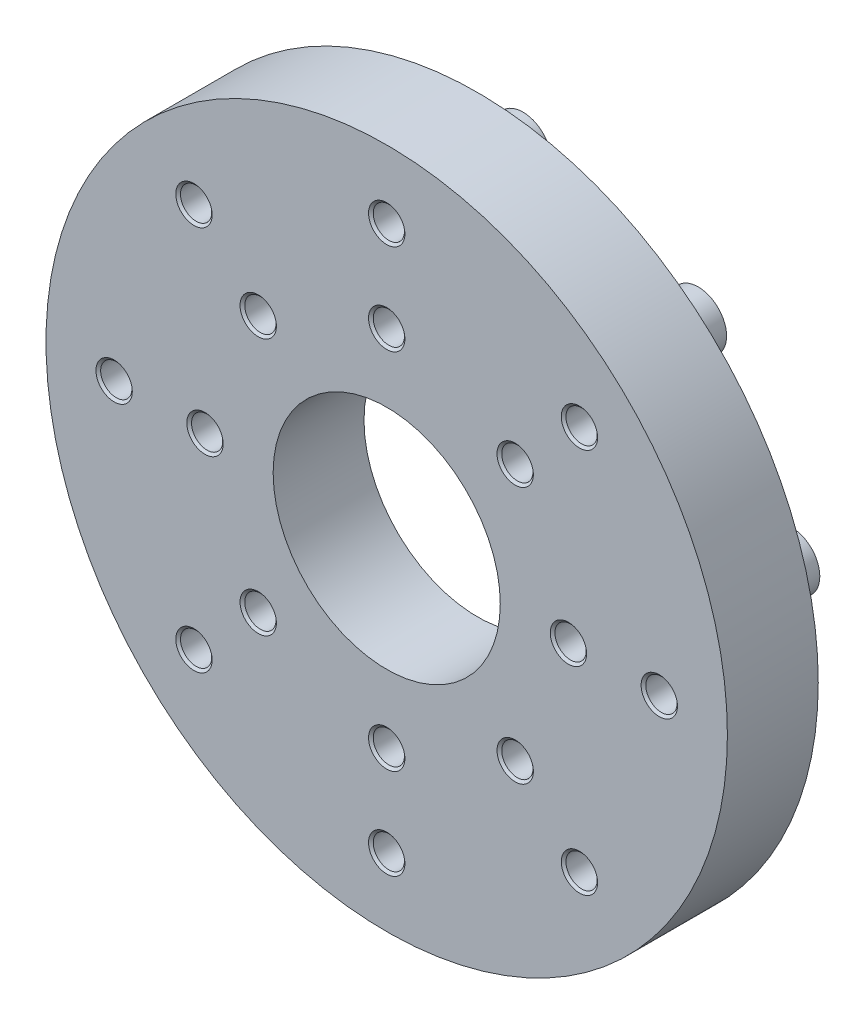
from build123d import *

# Parameters (mm, degrees)
SKETCH1_R                         = 190.5
BOSS_EXTRUDE1_DEPTH               = 50.8
SKETCH2_R                         = 63.5
CUT_EXTRUDE1_DEPTH                = 275.155320941
F_3_4_16_TAPPED_HOLE1_D           = 17.4625
F_3_4_16_TAPPED_HOLE1_DEPTH       = 42.926
F_3_4_16_TAPPED_HOLE1_CSINK_D     = 20.32
F_3_4_16_TAPPED_HOLE1_CSINK_ANGLE = 100
F_3_4_16_TAPPED_HOLE1_TIP         = 5.24626428
SKETCH5_R                         = 15.875
BOSS_EXTRUDE2_DEPTH               = 25.4


with BuildPart() as part:
    # Sketch1 → Boss-Extrude1 (new body)
    with BuildSketch(Plane.XY):
        Circle(SKETCH1_R)
    extrude(amount=BOSS_EXTRUDE1_DEPTH)

    # Sketch2 → Cut-Extrude1 (cut, through all)
    with BuildSketch(Plane.XY.offset(50.8)):
        Circle(SKETCH2_R)
    extrude(amount=-CUT_EXTRUDE1_DEPTH, mode=Mode.SUBTRACT)

    # 3/4-16 Tapped Hole1
    with Locations(Plane.XY.offset(50.8)):
        with Locations((0, 0), (0, 152.4), (0, 101.6), (71.842048969, 71.842048969), (101.6, 0), (107.763073453, 107.763073453), (71.842048969, -71.842048969), (0, -101.6), (-71.842048969, -71.842048969), (-101.6, 0), (-71.842048969, 71.842048969), (152.4, 0), (107.763073453, -107.763073453), (0, -152.4), (-107.763073453, -107.763073453), (-152.4, 0), (-107.763073453, 107.763073453)):
            CounterSinkHole(F_3_4_16_TAPPED_HOLE1_D / 2, F_3_4_16_TAPPED_HOLE1_CSINK_D / 2, depth=F_3_4_16_TAPPED_HOLE1_DEPTH, counter_sink_angle=F_3_4_16_TAPPED_HOLE1_CSINK_ANGLE)
            with Locations((0, 0, -(F_3_4_16_TAPPED_HOLE1_DEPTH + F_3_4_16_TAPPED_HOLE1_TIP / 2))):  # 118° drill point
                Cone(0, F_3_4_16_TAPPED_HOLE1_D / 2, F_3_4_16_TAPPED_HOLE1_TIP, mode=Mode.SUBTRACT)

    # Sketch5 → Boss-Extrude2 (add)
    with BuildSketch(Plane(origin=(0, 0, 0), x_dir=(-1, 0, 0), z_dir=(0, 0, -1))):
        with Locations(Location((0, 152.4, 0), (0, 0, 180))):
            Circle(SKETCH5_R)
        with Locations(Location((97.960831716, 116.745173131, 0), (0, 0, 180))):
            Circle(SKETCH5_R)
        with Locations(Location((150.084701559, 26.463982276, 0), (0, 0, 180))):
            Circle(SKETCH5_R)
        with Locations(Location((131.982271537, -76.2, 0), (0, 0, 180))):
            Circle(SKETCH5_R)
        with Locations(Location((52.123869843, -143.209155408, 0), (0, 0, 180))):
            Circle(SKETCH5_R)
        with Locations(Location((-52.123869843, -143.209155408, 0), (0, 0, 180))):
            Circle(SKETCH5_R)
        with Locations(Location((-131.982271537, -76.2, 0), (0, 0, 180))):
            Circle(SKETCH5_R)
        with Locations(Location((-150.084701559, 26.463982276, 0), (0, 0, 180))):
            Circle(SKETCH5_R)
        with Locations(Location((-97.960831716, 116.745173131, 0), (0, 0, 180))):
            Circle(SKETCH5_R)
    extrude(amount=BOSS_EXTRUDE2_DEPTH)


solid = part.part
